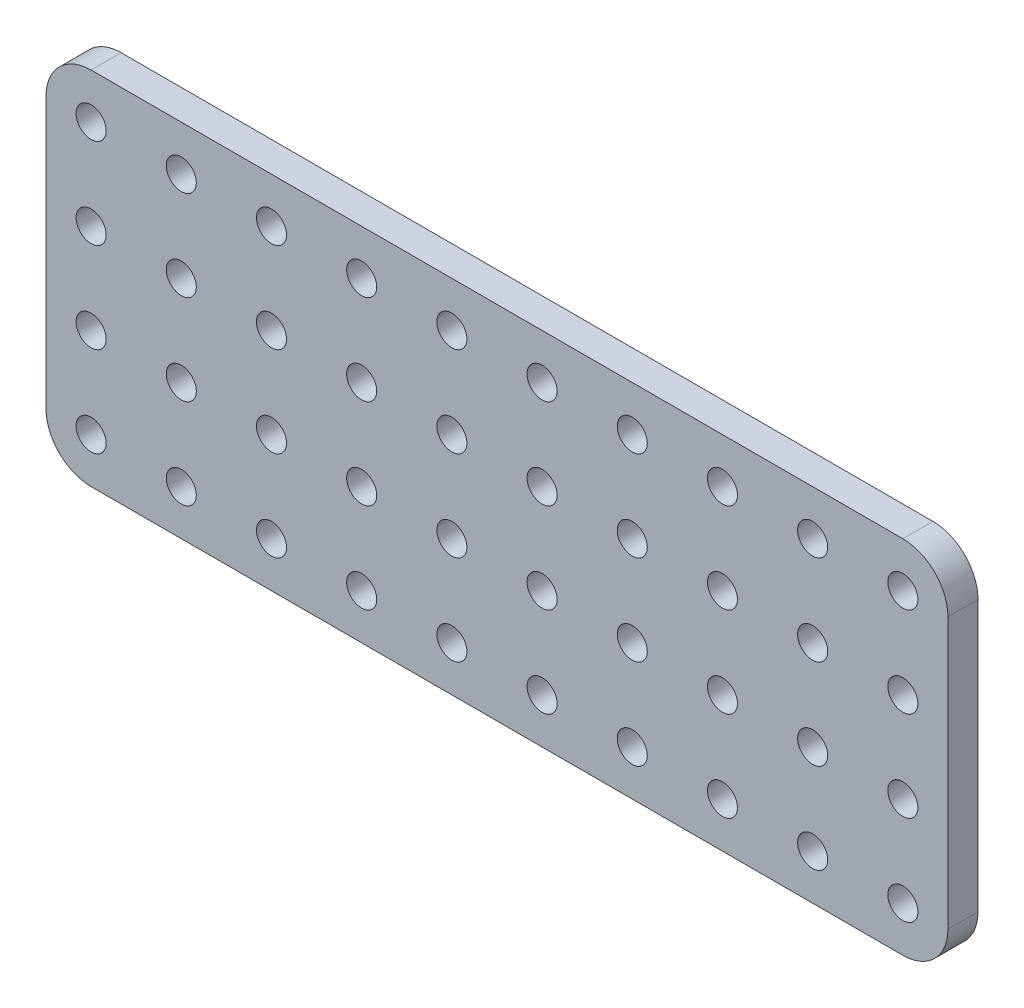
from build123d import *

# Parameters (mm, degrees)
MODEL_R                 = 1.5
SALIENTE_EXTRUIR1_DEPTH = 3


with BuildPart() as part:
    # Model → Saliente-Extruir1 (new body)
    with BuildSketch(Plane.XY):
        with BuildLine():
            Line((-105.943383637, 101.056539338), (-105.943383637, 74.056539338))
            ThreePointArc((-105.943383637, 74.056539338), (-104.625364152, 70.874558823), (-101.443383637, 69.556539338))
            Line((-101.443383637, 69.556539338), (-20.443383637, 69.556539338))
            ThreePointArc((-20.443383637, 69.556539338), (-17.261403122, 70.874558823), (-15.943383637, 74.056539338))
            Line((-15.943383637, 74.056539338), (-15.943383637, 101.056539338))
            ThreePointArc((-15.943383637, 101.056539338), (-17.261403122, 104.238519853), (-20.443383637, 105.556539338))
            Line((-20.443383637, 105.556539338), (-101.443383637, 105.556539338))
            ThreePointArc((-101.443383637, 105.556539338), (-104.625364152, 104.238519853), (-105.943383637, 101.056539338))
        make_face()
        with Locations((-101.443383637, 101.056539338)):
            Circle(MODEL_R, mode=Mode.SUBTRACT)
        with Locations((-92.443383637, 101.056539338)):
            Circle(MODEL_R, mode=Mode.SUBTRACT)
        with Locations((-83.443383637, 101.056539338)):
            Circle(MODEL_R, mode=Mode.SUBTRACT)
        with Locations((-74.443383637, 101.056539338)):
            Circle(MODEL_R, mode=Mode.SUBTRACT)
        with Locations((-65.443383637, 101.056539338)):
            Circle(MODEL_R, mode=Mode.SUBTRACT)
        with Locations((-56.443383637, 101.056539338)):
            Circle(MODEL_R, mode=Mode.SUBTRACT)
        with Locations((-47.443383637, 101.056539338)):
            Circle(MODEL_R, mode=Mode.SUBTRACT)
        with Locations((-38.443383637, 101.056539338)):
            Circle(MODEL_R, mode=Mode.SUBTRACT)
        with Locations((-101.443383637, 92.056539338)):
            Circle(MODEL_R, mode=Mode.SUBTRACT)
        with Locations((-92.443383637, 92.056539338)):
            Circle(MODEL_R, mode=Mode.SUBTRACT)
        with Locations((-83.443383637, 92.056539338)):
            Circle(MODEL_R, mode=Mode.SUBTRACT)
        with Locations((-74.443383637, 92.056539338)):
            Circle(MODEL_R, mode=Mode.SUBTRACT)
        with Locations((-65.443383637, 92.056539338)):
            Circle(MODEL_R, mode=Mode.SUBTRACT)
        with Locations((-56.443383637, 92.056539338)):
            Circle(MODEL_R, mode=Mode.SUBTRACT)
        with Locations((-47.443383637, 92.056539338)):
            Circle(MODEL_R, mode=Mode.SUBTRACT)
        with Locations((-38.443383637, 92.056539338)):
            Circle(MODEL_R, mode=Mode.SUBTRACT)
        with Locations((-101.443383637, 83.056539338)):
            Circle(MODEL_R, mode=Mode.SUBTRACT)
        with Locations((-92.443383637, 83.056539338)):
            Circle(MODEL_R, mode=Mode.SUBTRACT)
        with Locations((-83.443383637, 83.056539338)):
            Circle(MODEL_R, mode=Mode.SUBTRACT)
        with Locations((-74.443383637, 83.056539338)):
            Circle(MODEL_R, mode=Mode.SUBTRACT)
        with Locations((-65.443383637, 83.056539338)):
            Circle(MODEL_R, mode=Mode.SUBTRACT)
        with Locations((-56.443383637, 83.056539338)):
            Circle(MODEL_R, mode=Mode.SUBTRACT)
        with Locations((-47.443383637, 83.056539338)):
            Circle(MODEL_R, mode=Mode.SUBTRACT)
        with Locations((-38.443383637, 83.056539338)):
            Circle(MODEL_R, mode=Mode.SUBTRACT)
        with Locations((-101.443383637, 74.056539338)):
            Circle(MODEL_R, mode=Mode.SUBTRACT)
        with Locations((-92.443383637, 74.056539338)):
            Circle(MODEL_R, mode=Mode.SUBTRACT)
        with Locations((-83.443383637, 74.056539338)):
            Circle(MODEL_R, mode=Mode.SUBTRACT)
        with Locations((-74.443383637, 74.056539338)):
            Circle(MODEL_R, mode=Mode.SUBTRACT)
        with Locations((-65.443383637, 74.056539338)):
            Circle(MODEL_R, mode=Mode.SUBTRACT)
        with Locations((-56.443383637, 74.056539338)):
            Circle(MODEL_R, mode=Mode.SUBTRACT)
        with Locations((-47.443383637, 74.056539338)):
            Circle(MODEL_R, mode=Mode.SUBTRACT)
        with Locations((-38.443383637, 74.056539338)):
            Circle(MODEL_R, mode=Mode.SUBTRACT)
        with Locations((-29.443383637, 101.056539338)):
            Circle(MODEL_R, mode=Mode.SUBTRACT)
        with Locations((-29.443383637, 92.056539338)):
            Circle(MODEL_R, mode=Mode.SUBTRACT)
        with Locations((-29.443383637, 83.056539338)):
            Circle(MODEL_R, mode=Mode.SUBTRACT)
        with Locations((-29.443383637, 74.056539338)):
            Circle(MODEL_R, mode=Mode.SUBTRACT)
        with Locations((-20.443383637, 101.056539338)):
            Circle(MODEL_R, mode=Mode.SUBTRACT)
        with Locations((-20.443383637, 92.056539338)):
            Circle(MODEL_R, mode=Mode.SUBTRACT)
        with Locations((-20.443383637, 83.056539338)):
            Circle(MODEL_R, mode=Mode.SUBTRACT)
        with Locations((-20.443383637, 74.056539338)):
            Circle(MODEL_R, mode=Mode.SUBTRACT)
    extrude(amount=SALIENTE_EXTRUIR1_DEPTH)


solid = part.part
